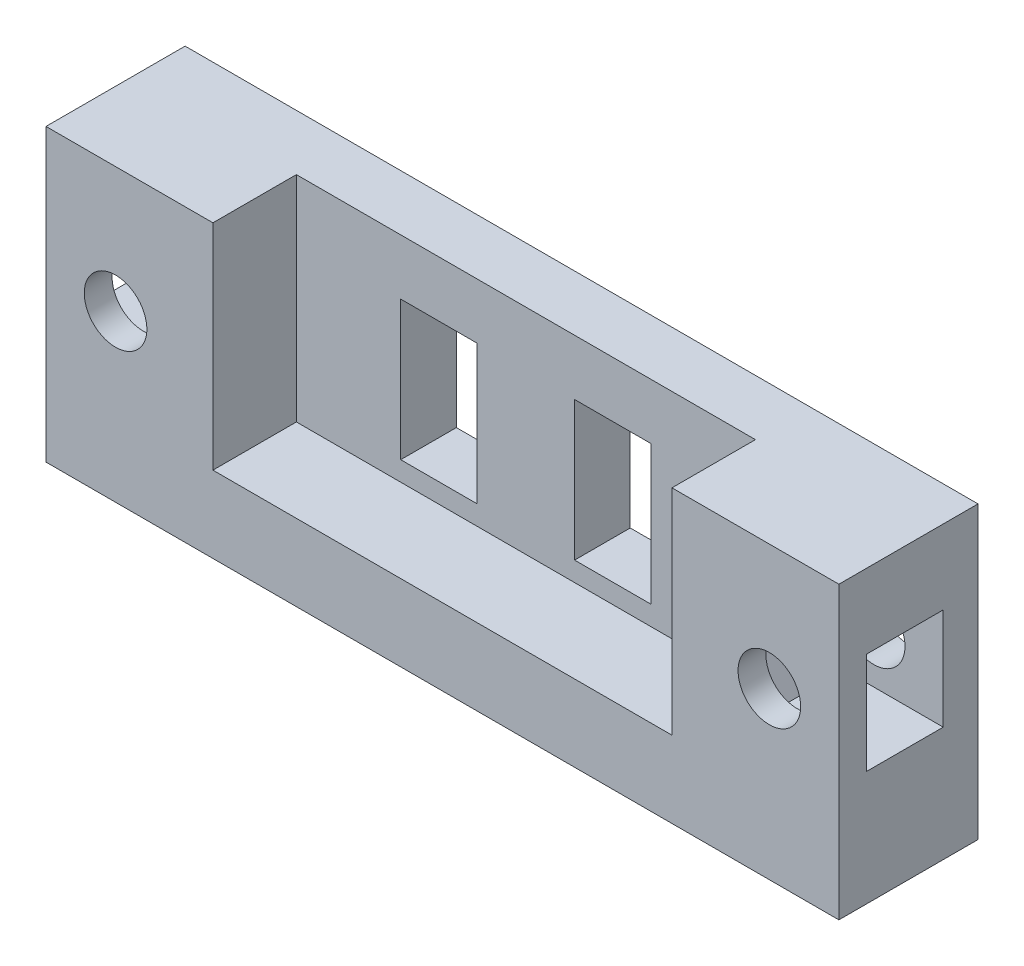
from build123d import *

# Parameters (mm, degrees)
ESQUISSE1_W             = 57
ESQUISSE1_H             = 20.9
ESQUISSE1_R             = 2.25
ESQUISSE1_W_2           = 5.5
ESQUISSE1_H_2           = 10
BOSS_EXTRU_2_DEPTH      = 4
ESQUISSE2_W             = 16.5
ESQUISSE2_H             = 5.5
ESQUISSE2_R             = 2.25
BOSS_EXTRU_3_DEPTH      = 6
ENL_V_START             = -7.5
ESQUISSE4_R             = 2.25
ENL_V_MAT_EXTRU_2_DEPTH = 5.5


with BuildPart() as part:
    # Esquisse1 → Boss.-Extru.2 (new body)
    with BuildSketch(Plane.XY):
        with Locations((28.5, -10.45)):
            Rectangle(ESQUISSE1_W, ESQUISSE1_H)
        with Locations((5, -9)):
            Circle(ESQUISSE1_R, mode=Mode.SUBTRACT)
        with Locations((52, -9)):
            Circle(ESQUISSE1_R, mode=Mode.SUBTRACT)
        with Locations((34.75, -9)):
            Rectangle(ESQUISSE1_W_2, ESQUISSE1_H_2, mode=Mode.SUBTRACT)
        with Locations((22.25, -9)):
            Rectangle(ESQUISSE1_W_2, ESQUISSE1_H_2, mode=Mode.SUBTRACT)
    extrude(amount=BOSS_EXTRU_2_DEPTH)

    # Esquisse2 → Boss.-Extru.3 (add)
    # profile 1 of 2: a face of its own
    with BuildSketch(Plane.XY.offset(4)):
        with Locations((36.75, -18.15)):
            Rectangle(ESQUISSE2_W, ESQUISSE2_H)
    # profile 2 of 2: a face of its own
    with BuildSketch(Plane.XY.offset(4)):
        Polygon((57, -20.9), (57, 0), (45, 0), (45, -15.4), (45, -20.9), align=None)
        with Locations((52, -9)):
            Circle(ESQUISSE2_R, mode=Mode.SUBTRACT)
    boss_extru_3 = extrude(amount=BOSS_EXTRU_3_DEPTH)

    # Esquisse4 → Enlèv. mat.-Extru.2 (cut)
    # profile 1 of 2: a face of its own
    with BuildSketch(Plane.XY.offset(10).offset(ENL_V_START)):
        Polygon((56.214656965, -9), (54.107328483, -5.35), (49.892671517, -5.35), (47.785343035, -9), (49.892671517, -12.65), (54.107328483, -12.65), align=None)
        with Locations((52, -9)):
            Circle(ESQUISSE4_R, mode=Mode.SUBTRACT)
    # profile 2 of 2: a face of its own
    with BuildSketch(Plane.XY.offset(10).offset(ENL_V_START)):
        Polygon((57, -5.35), (54.107328483, -5.35), (56.214656965, -9), (54.107328483, -12.65), (57, -12.65), align=None)
    enl_v_mat_extru_2 = extrude(amount=ENL_V_MAT_EXTRU_2_DEPTH, mode=Mode.SUBTRACT)

    # Symétrie3: Boss.-Extru.3, Enlèv. mat.-Extru.2 across plane
    add(boss_extru_3.mirror(Plane(origin=(28.5, 0, 0), x_dir=(0, 0, 1), z_dir=(1, 0, 0))))
    add(enl_v_mat_extru_2.mirror(Plane(origin=(28.5, 0, 0), x_dir=(0, 0, 1), z_dir=(1, 0, 0))), mode=Mode.SUBTRACT)


solid = part.part
